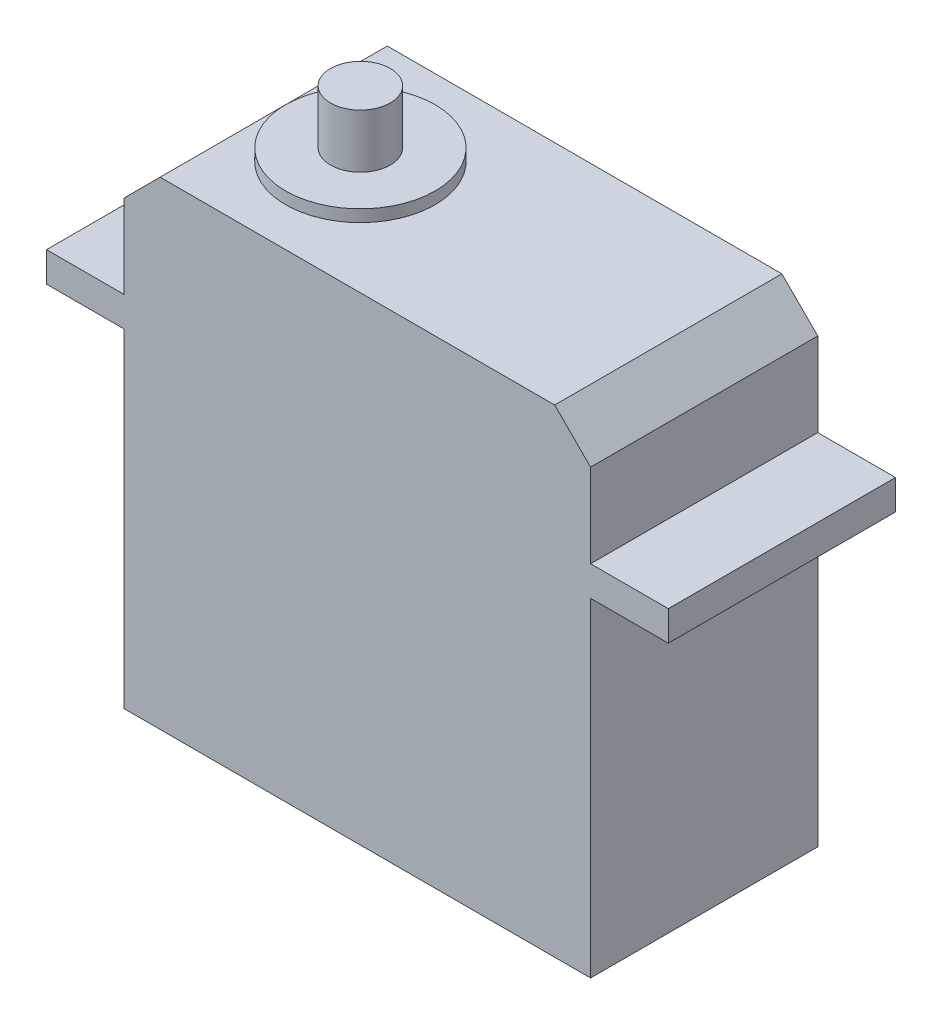
from build123d import *

# Parameters (mm, degrees)
SKETCH1_W           = 39
SKETCH1_H           = 19
BOSS_EXTRUDE1_DEPTH = 40
SKETCH2_W           = 19
SKETCH2_H           = 2.5
BOSS_EXTRUDE2_DEPTH = 6.5
SKETCH3_W           = 19
SKETCH3_H           = 2.5
BOSS_EXTRUDE3_DEPTH = 6.5
SKETCH4_R           = 6.25
BOSS_EXTRUDE4_DEPTH = 1
SKETCH5_R           = 2.5
BOSS_EXTRUDE5_DEPTH = 4.5
CHAMFER1_SIZE       = 3
CHAMFER2_SIZE       = 3


with BuildPart() as part:
    # Sketch1 → Boss-Extrude1 (new body)
    with BuildSketch(Plane(origin=(0, 0, 0), x_dir=(1, 0, 0), z_dir=(0, 1, 0))):
        with Locations((19.5, 9.5)):
            Rectangle(SKETCH1_W, SKETCH1_H)
    extrude(amount=BOSS_EXTRUDE1_DEPTH)

    # Sketch2 → Boss-Extrude2 (add)
    with BuildSketch(Plane(origin=(39, 0, 0), x_dir=(0, 0, -1), z_dir=(1, 0, 0))):
        with Locations((9.5, 28.75)):
            Rectangle(SKETCH2_W, SKETCH2_H)
    extrude(amount=BOSS_EXTRUDE2_DEPTH)

    # Sketch3 → Boss-Extrude3 (add)
    with BuildSketch(Plane.ZY):
        with Locations((-9.5, 28.75)):
            Rectangle(SKETCH3_W, SKETCH3_H)
    extrude(amount=BOSS_EXTRUDE3_DEPTH)

    # Sketch4 → Boss-Extrude4 (add)
    with BuildSketch(Plane(origin=(0, 40, 0), x_dir=(1, 0, 0), z_dir=(0, 1, 0))):
        with Locations(Location((10.25, 9.5, 0), (0, 0, 90))):
            Circle(SKETCH4_R)
    extrude(amount=BOSS_EXTRUDE4_DEPTH)

    # Sketch5 → Boss-Extrude5 (add)
    with BuildSketch(Plane(origin=(0, 41, 0), x_dir=(1, 0, 0), z_dir=(0, 1, 0))):
        with Locations(Location((10.25, 9.5, 0), (0, 0, 270))):
            Circle(SKETCH5_R)
    extrude(amount=BOSS_EXTRUDE5_DEPTH)

    # Chamfer1
    chamfer1_edges = [part.edges().sort_by_distance(p)[0] for p in [
        (0, 40, -9.5),
    ]]
    chamfer(chamfer1_edges, length=CHAMFER1_SIZE)

    # Chamfer2
    chamfer2_edges = [part.edges().sort_by_distance(p)[0] for p in [
        (39, 40, -9.5),
    ]]
    chamfer(chamfer2_edges, length=CHAMFER2_SIZE)


solid = part.part
